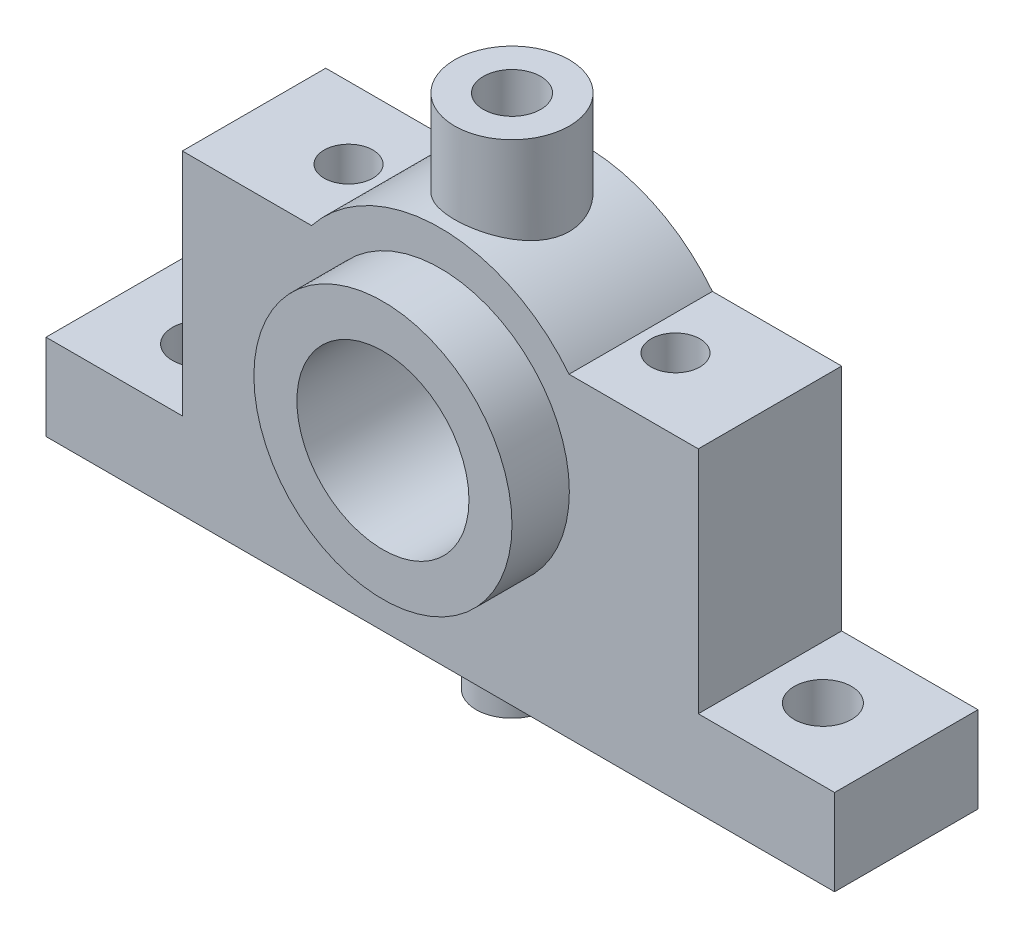
from build123d import *

# Parameters (mm, degrees)
SKETCH2_R                       = 14.2875
BOSS_EXTRUDE1_DEPTH             = 7.9375
BOSS_EXTRUDE2_DEPTH             = 14.2875
BOSS_EXTRUDE2_DEPTH_BACK        = 11.1125
SKETCH4_R                       = 14.2875
SKETCH4_R_2                     = 9.525
SKETCH5_R                       = 3.96875
BOSS_EXTRUDE3_DEPTH             = 6.35
SKETCH6_R                       = 6.35
BOSS_EXTRUDE4_DEPTH             = 12.7
SKETCH7_R                       = 3.175
CUT_EXTRUDE1_DEPTH              = 19.05
F_1_4_28_TAPPED_HOLE1_D         = 5.4102
F_1_4_28_TAPPED_HOLE1_DEPTH     = 25.4
F_1_4_28_TAPPED_HOLE1_TIP       = 1.625388061
F_1_4_0_25_DIAMETER_HOLE1_D     = 6.35
F_1_4_0_25_DIAMETER_HOLE1_DEPTH = 12.7
F_1_4_0_25_DIAMETER_HOLE1_TIP   = 1.907732465
SKETCH21_R                      = 0.508
CUT_EXTRUDE2_DEPTH              = 19.05
CUT_EXTRUDE3_START              = -1.5875
SKETCH22_R                      = 14.2875
SKETCH22_R_2                    = 9.525
CUT_EXTRUDE3_DEPTH              = 1.5875


with BuildPart() as part:
    # Sketch2 → Boss-Extrude1 (new, symmetric)
    with BuildSketch(Plane.XY):
        with BuildLine():
            Line((43.6499, 0), (-43.6499, 0))
            Line((-43.6499, 0), (-43.6499, 9.525))
            Line((-43.6499, 9.525), (-28.557248061, 9.525))
            Line((-28.557248061, 9.525), (-28.557248061, 34.925))
            Line((-28.557248061, 34.925), (-14.251577109, 34.925))
            ThreePointArc((-14.251577109, 34.925), (0, 41.830978734), (14.251577109, 34.925))
            Line((14.251577109, 34.925), (28.557248061, 34.925))
            Line((28.557248061, 34.925), (28.557248061, 9.525))
            Line((28.557248061, 9.525), (43.6499, 9.525))
            Line((43.6499, 9.525), (43.6499, 0))
        make_face()
        with Locations((0, 23.6728)):
            Circle(SKETCH2_R, mode=Mode.SUBTRACT)
    extrude(amount=BOSS_EXTRUDE1_DEPTH, both=True)

    # Sketch4 → Boss-Extrude2 (add, two sides: drawn at the far end of the back side and taken through both)
    with BuildSketch(Plane.XY.offset(-BOSS_EXTRUDE2_DEPTH_BACK)):
        with Locations((0, 23.6728)):
            Circle(SKETCH4_R)
        with Locations((0, 23.6728)):
            Circle(SKETCH4_R_2, mode=Mode.SUBTRACT)
    extrude(amount=BOSS_EXTRUDE2_DEPTH + BOSS_EXTRUDE2_DEPTH_BACK)

    # Sketch5 → Boss-Extrude3 (add)
    with BuildSketch(Plane.XZ):
        with Locations(Location((0, 0, 0), (0, 0, 90))):
            Circle(SKETCH5_R)
    extrude(amount=BOSS_EXTRUDE3_DEPTH)

    # Sketch6 → Boss-Extrude4 (add)
    with BuildSketch(Plane(origin=(0, 38.1, 0), x_dir=(1, 0, 0), z_dir=(0, 1, 0))):
        with Locations(Location((0, 0, 0), (0, 0, 90))):
            Circle(SKETCH6_R)
    extrude(amount=BOSS_EXTRUDE4_DEPTH)

    # Sketch7 → Cut-Extrude1 (cut)
    with BuildSketch(Plane(origin=(0, 9.525, 0), x_dir=(1, 0, 0), z_dir=(0, 1, 0))):
        with Locations(Location((34.417, 0, 0), (0, 0, 270))):
            Circle(SKETCH7_R)
        with Locations(Location((-34.417, 0, 0), (0, 0, 270))):
            Circle(SKETCH7_R)
    extrude(amount=-CUT_EXTRUDE1_DEPTH, mode=Mode.SUBTRACT)

    # 1/4-28 Tapped Hole1
    with Locations(Plane(origin=(-18.0975, 34.925, 0), x_dir=(0, 0, 1), z_dir=(0, 1, 0))):
        with Locations((0, 0), (0, 36.195)):
            Hole(F_1_4_28_TAPPED_HOLE1_D / 2, depth=F_1_4_28_TAPPED_HOLE1_DEPTH)
            with Locations((0, 0, -(F_1_4_28_TAPPED_HOLE1_DEPTH + F_1_4_28_TAPPED_HOLE1_TIP / 2))):  # 118° drill point
                Cone(0, F_1_4_28_TAPPED_HOLE1_D / 2, F_1_4_28_TAPPED_HOLE1_TIP, mode=Mode.SUBTRACT)

    # 1/4 (0.25) Diameter Hole1
    with Locations(Plane(origin=(0, 50.8, 0), x_dir=(1, 0, 0), z_dir=(0, 1, 0))):
        with Locations((0, 0)):
            Hole(F_1_4_0_25_DIAMETER_HOLE1_D / 2, depth=F_1_4_0_25_DIAMETER_HOLE1_DEPTH)
            with Locations((0, 0, -(F_1_4_0_25_DIAMETER_HOLE1_DEPTH + F_1_4_0_25_DIAMETER_HOLE1_TIP / 2))):  # 118° drill point
                Cone(0, F_1_4_0_25_DIAMETER_HOLE1_D / 2, F_1_4_0_25_DIAMETER_HOLE1_TIP, mode=Mode.SUBTRACT)

    # Sketch21 → Cut-Extrude2 (cut)
    with BuildSketch(Plane(origin=(0, 50.8, 0), x_dir=(1, 0, 0), z_dir=(0, 1, 0))):
        with Locations(Location((0, 0, 0), (0, 0, 270))):
            Circle(SKETCH21_R)
    extrude(amount=-CUT_EXTRUDE2_DEPTH, mode=Mode.SUBTRACT)

    # Sketch22 → Cut-Extrude3 (cut)
    with BuildSketch(Plane(origin=(0, 0, -11.1125), x_dir=(-1, 0, 0), z_dir=(0, 0, -1)).offset(CUT_EXTRUDE3_START)):
        with Locations(Location((0, 23.6728, 0), (0, 0, 180))):
            Circle(SKETCH22_R)
        with Locations(Location((0, 23.6728, 0), (0, 0, 180))):
            Circle(SKETCH22_R_2, mode=Mode.SUBTRACT)
    extrude(amount=CUT_EXTRUDE3_DEPTH, mode=Mode.SUBTRACT)


solid = part.part
